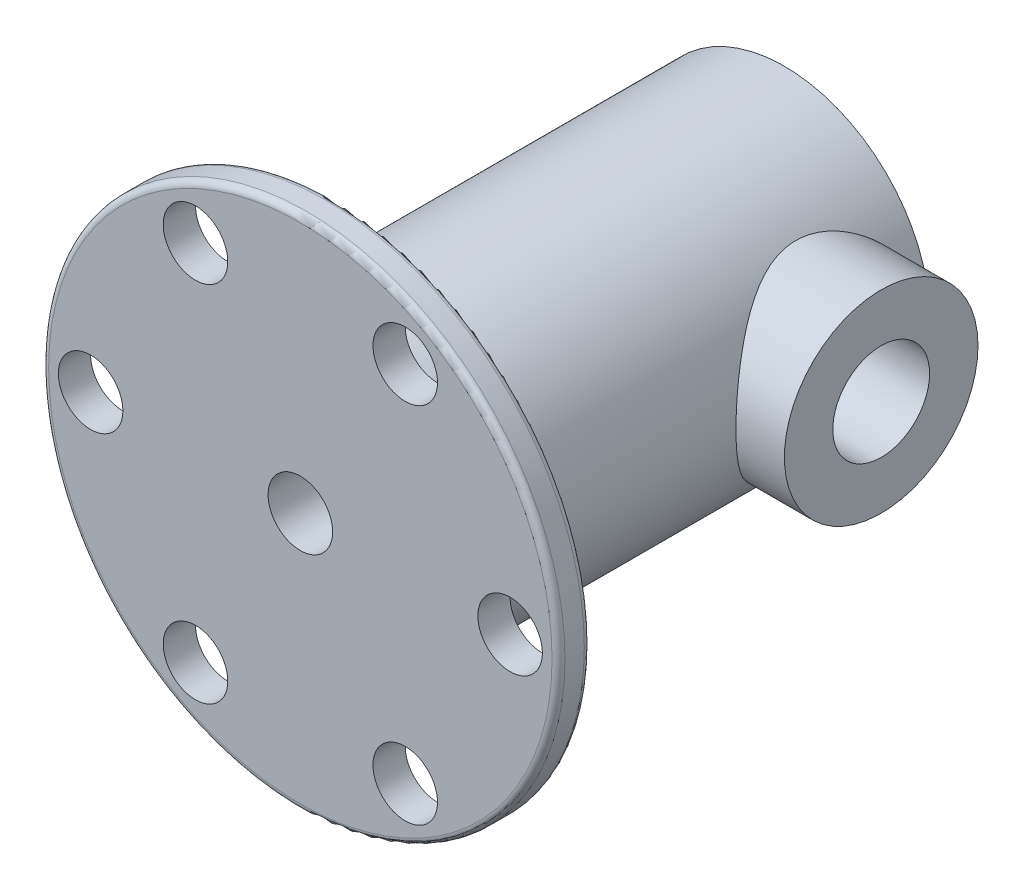
from build123d import *

# Parameters (mm, degrees)
SKETCH_1_R          = 80
EXTRUDE_1_DEPTH     = 10
SKETCH_2_R          = 10
CUT_EXTRUDE_1_DEPTH = 10
SKETCH_3_R          = 45
EXTRUDE_2_DEPTH     = 140
SKETCH_6_R          = 10
CUT_EXTRUDE_3_DEPTH = 181
SKETCH_7_R          = 30
SKETCH_7_R_2        = 15
EXTRUDE_3_DEPTH     = 60
SKETCH_8_R          = 15
CUT_EXTRUDE_4_DEPTH = 45
SKETCH_9_R          = 10
CUT_EXTRUDE_5_DEPTH = 200
FILLET_1_R          = 2


with BuildPart() as part:
    # 草图1 → 凸台-拉伸1 (new body)
    with BuildSketch(Plane.XY):
        Circle(SKETCH_1_R)
    extrude(amount=EXTRUDE_1_DEPTH)

    # 草图2 → 切除-拉伸1 (cut)
    with BuildSketch(Plane.XY):
        with Locations((32.5, 56.291651246)):
            Circle(SKETCH_2_R)
        with Locations((-32.5, -56.291651246)):
            Circle(SKETCH_2_R)
        with Locations((-65, 0)):
            Circle(SKETCH_2_R)
        with Locations((-32.5, 56.291651246)):
            Circle(SKETCH_2_R)
        with Locations((65, 0)):
            Circle(SKETCH_2_R)
        with Locations((32.5, -56.291651246)):
            Circle(SKETCH_2_R)
    extrude(amount=CUT_EXTRUDE_1_DEPTH, mode=Mode.SUBTRACT)

    # 草图3 → 凸台-拉伸2 (add)
    with BuildSketch(Plane.XY):
        Circle(SKETCH_3_R)
    extrude(amount=-EXTRUDE_2_DEPTH)

    # 草图6 → 切除-拉伸3 (cut, through all)
    with BuildSketch(Plane.XY):
        Circle(SKETCH_6_R)
    extrude(amount=-CUT_EXTRUDE_3_DEPTH, mode=Mode.SUBTRACT)

    # 草图7 → 凸台-拉伸3 (add)
    with BuildSketch(Plane(origin=(0, 0, 0), x_dir=(0, 0, -1), z_dir=(1, 0, 0))):
        with Locations((110, 0)):
            Circle(SKETCH_7_R)
        with Locations((110, 0)):
            Circle(SKETCH_7_R_2, mode=Mode.SUBTRACT)
    extrude(amount=EXTRUDE_3_DEPTH)

    # 草图8 → 切除-拉伸4 (cut, symmetric)
    with BuildSketch(Plane(origin=(0, 0, 0), x_dir=(0, 0, -1), z_dir=(1, 0, 0))):
        with Locations((110, 0)):
            Circle(SKETCH_8_R)
    extrude(amount=CUT_EXTRUDE_4_DEPTH, both=True, mode=Mode.SUBTRACT)

    # 草图9 → 切除-拉伸5 (cut)
    with BuildSketch(Plane.XY.offset(10)):
        Circle(SKETCH_9_R)
    extrude(amount=-CUT_EXTRUDE_5_DEPTH, mode=Mode.SUBTRACT)

    # 圆角1
    fillet_1_edges = [part.edges().sort_by_distance(p)[0] for p in [
        (-80, 0, 0),
        (-80, 0, 10),
    ]]
    fillet(fillet_1_edges, radius=FILLET_1_R)


solid = part.part
